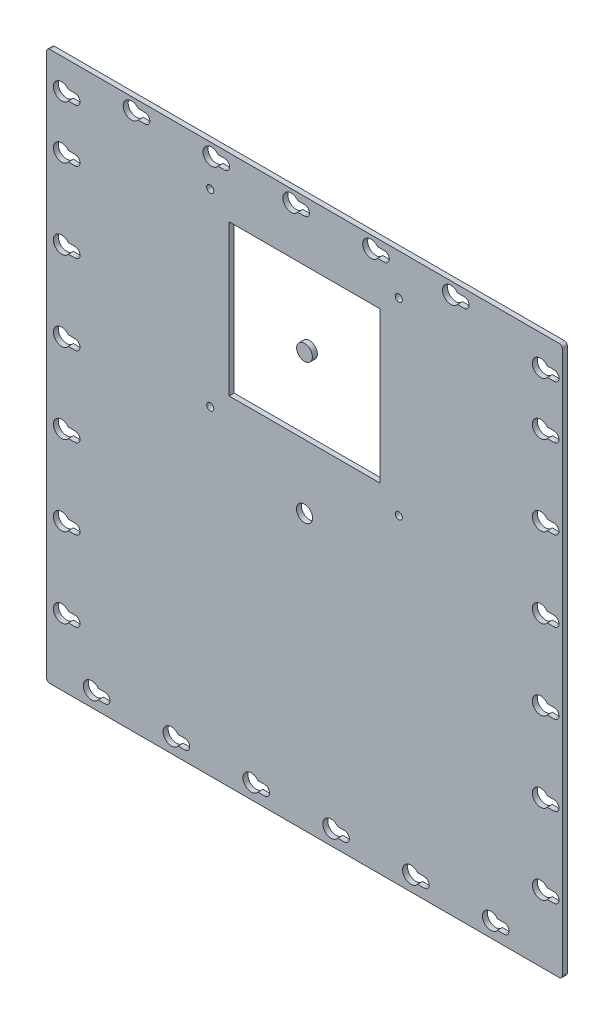
from build123d import *

# Parameters (mm, degrees)
SKETCH1_W           = 164.1
SKETCH1_H           = 174.745
SKETCH1_R           = 2.5527
BOSS_EXTRUDE1_DEPTH = 1.5875
FILLET1_R           = 1
SKETCH2_W           = 48
SKETCH2_H           = 48
SKETCH2_R           = 2.5
SKETCH2_R_2         = 1.13
CUT_EXTRUDE1_DEPTH  = 10


with BuildPart() as part:
    # Sketch1 → Boss-Extrude1 (new body)
    with BuildSketch(Plane.XY):
        with Locations((82.55, -87.3725)):
            Rectangle(SKETCH1_W, SKETCH1_H)
        with Locations((82.55, -87.3725)):
            Circle(SKETCH1_R, mode=Mode.SUBTRACT)
        with BuildLine():
            Line((82.55, -5.4375), (80.434372699, -5.4375))
            ThreePointArc((80.434372699, -5.4375), (75.6625, -3.85), (80.434372699, -2.2625))
            Line((80.434372699, -2.2625), (82.55, -2.2625))
            ThreePointArc((82.55, -2.2625), (84.1375, -3.85), (82.55, -5.4375))
        make_face(mode=Mode.SUBTRACT)
        with BuildLine():
            Line((16.934372699, -168.395), (19.05, -168.395))
            ThreePointArc((19.05, -168.395), (20.6375, -169.9825), (19.05, -171.57))
            Line((19.05, -171.57), (16.934372699, -171.57))
            ThreePointArc((16.934372699, -171.57), (12.1625, -169.9825), (16.934372699, -168.395))
        make_face(mode=Mode.SUBTRACT)
        with BuildLine():
            Line((7.409372699, -151.9325), (9.525, -151.9325))
            ThreePointArc((9.525, -151.9325), (11.1125, -153.52), (9.525, -155.1075))
            Line((9.525, -155.1075), (7.409372699, -155.1075))
            ThreePointArc((7.409372699, -155.1075), (2.6375, -153.52), (7.409372699, -151.9325))
        make_face(mode=Mode.SUBTRACT)
        with BuildLine():
            Line((42.334372699, -168.395), (44.45, -168.395))
            ThreePointArc((44.45, -168.395), (46.0375, -169.9825), (44.45, -171.57))
            Line((44.45, -171.57), (42.334372699, -171.57))
            ThreePointArc((42.334372699, -171.57), (37.5625, -169.9825), (42.334372699, -168.395))
        make_face(mode=Mode.SUBTRACT)
        with BuildLine():
            Line((67.734372699, -168.395), (69.85, -168.395))
            ThreePointArc((69.85, -168.395), (71.4375, -169.9825), (69.85, -171.57))
            Line((69.85, -171.57), (67.734372699, -171.57))
            ThreePointArc((67.734372699, -171.57), (62.9625, -169.9825), (67.734372699, -168.395))
        make_face(mode=Mode.SUBTRACT)
        with BuildLine():
            Line((7.409372699, -126.5325), (9.525, -126.5325))
            ThreePointArc((9.525, -126.5325), (11.1125, -128.12), (9.525, -129.7075))
            Line((9.525, -129.7075), (7.409372699, -129.7075))
            ThreePointArc((7.409372699, -129.7075), (2.6375, -128.12), (7.409372699, -126.5325))
        make_face(mode=Mode.SUBTRACT)
        with BuildLine():
            Line((7.409372699, -101.1325), (9.525, -101.1325))
            ThreePointArc((9.525, -101.1325), (11.1125, -102.72), (9.525, -104.3075))
            Line((9.525, -104.3075), (7.409372699, -104.3075))
            ThreePointArc((7.409372699, -104.3075), (2.6375, -102.72), (7.409372699, -101.1325))
        make_face(mode=Mode.SUBTRACT)
        with BuildLine():
            Line((7.409372699, -75.7325), (9.525, -75.7325))
            ThreePointArc((9.525, -75.7325), (11.1125, -77.32), (9.525, -78.9075))
            Line((9.525, -78.9075), (7.409372699, -78.9075))
            ThreePointArc((7.409372699, -78.9075), (2.6375, -77.32), (7.409372699, -75.7325))
        make_face(mode=Mode.SUBTRACT)
        with BuildLine():
            Line((7.409372699, -50.3325), (9.525, -50.3325))
            ThreePointArc((9.525, -50.3325), (11.1125, -51.92), (9.525, -53.5075))
            Line((9.525, -53.5075), (7.409372699, -53.5075))
            ThreePointArc((7.409372699, -53.5075), (2.6375, -51.92), (7.409372699, -50.3325))
        make_face(mode=Mode.SUBTRACT)
        with BuildLine():
            Line((7.409372699, -24.9325), (9.525, -24.9325))
            ThreePointArc((9.525, -24.9325), (11.1125, -26.52), (9.525, -28.1075))
            Line((9.525, -28.1075), (7.409372699, -28.1075))
            ThreePointArc((7.409372699, -28.1075), (2.6375, -26.52), (7.409372699, -24.9325))
        make_face(mode=Mode.SUBTRACT)
        with BuildLine():
            Line((7.409372699, -8.1), (9.525, -8.1))
            ThreePointArc((9.525, -8.1), (11.1125, -9.6875), (9.525, -11.275))
            Line((9.525, -11.275), (7.409372699, -11.275))
            ThreePointArc((7.409372699, -11.275), (2.6375, -9.6875), (7.409372699, -8.1))
        make_face(mode=Mode.SUBTRACT)
        with BuildLine():
            Line((29.634372699, -2.2625), (31.75, -2.2625))
            ThreePointArc((31.75, -2.2625), (33.3375, -3.85), (31.75, -5.4375))
            Line((31.75, -5.4375), (29.634372699, -5.4375))
            ThreePointArc((29.634372699, -5.4375), (24.8625, -3.85), (29.634372699, -2.2625))
        make_face(mode=Mode.SUBTRACT)
        with BuildLine():
            Line((55.034372699, -2.2625), (57.15, -2.2625))
            ThreePointArc((57.15, -2.2625), (58.7375, -3.85), (57.15, -5.4375))
            Line((57.15, -5.4375), (55.034372699, -5.4375))
            ThreePointArc((55.034372699, -5.4375), (50.2625, -3.85), (55.034372699, -2.2625))
        make_face(mode=Mode.SUBTRACT)
        with BuildLine():
            ThreePointArc((161.925, -8.1), (163.5125, -9.6875), (161.925, -11.275))
            Line((161.925, -11.275), (159.809372699, -11.275))
            ThreePointArc((159.809372699, -11.275), (155.0375, -9.6875), (159.809372699, -8.1))
            Line((159.809372699, -8.1), (161.925, -8.1))
        make_face(mode=Mode.SUBTRACT)
        with BuildLine():
            Line((93.134372699, -168.395), (95.25, -168.395))
            ThreePointArc((95.25, -168.395), (96.8375, -169.9825), (95.25, -171.57))
            Line((95.25, -171.57), (93.134372699, -171.57))
            ThreePointArc((93.134372699, -171.57), (88.3625, -169.9825), (93.134372699, -168.395))
        make_face(mode=Mode.SUBTRACT)
        with BuildLine():
            Line((118.534372699, -168.395), (120.65, -168.395))
            ThreePointArc((120.65, -168.395), (122.2375, -169.9825), (120.65, -171.57))
            Line((120.65, -171.57), (118.534372699, -171.57))
            ThreePointArc((118.534372699, -171.57), (113.7625, -169.9825), (118.534372699, -168.395))
        make_face(mode=Mode.SUBTRACT)
        with BuildLine():
            Line((143.934372699, -168.395), (146.05, -168.395))
            ThreePointArc((146.05, -168.395), (147.6375, -169.9825), (146.05, -171.57))
            Line((146.05, -171.57), (143.934372699, -171.57))
            ThreePointArc((143.934372699, -171.57), (139.1625, -169.9825), (143.934372699, -168.395))
        make_face(mode=Mode.SUBTRACT)
        with BuildLine():
            Line((159.809372699, -151.9325), (161.925, -151.9325))
            ThreePointArc((161.925, -151.9325), (163.5125, -153.52), (161.925, -155.1075))
            Line((161.925, -155.1075), (159.809372699, -155.1075))
            ThreePointArc((159.809372699, -155.1075), (155.0375, -153.52), (159.809372699, -151.9325))
        make_face(mode=Mode.SUBTRACT)
        with BuildLine():
            Line((159.809372699, -126.5325), (161.925, -126.5325))
            ThreePointArc((161.925, -126.5325), (163.5125, -128.12), (161.925, -129.7075))
            Line((161.925, -129.7075), (159.809372699, -129.7075))
            ThreePointArc((159.809372699, -129.7075), (155.0375, -128.12), (159.809372699, -126.5325))
        make_face(mode=Mode.SUBTRACT)
        with BuildLine():
            Line((159.809372699, -101.1325), (161.925, -101.1325))
            ThreePointArc((161.925, -101.1325), (163.5125, -102.72), (161.925, -104.3075))
            Line((161.925, -104.3075), (159.809372699, -104.3075))
            ThreePointArc((159.809372699, -104.3075), (155.0375, -102.72), (159.809372699, -101.1325))
        make_face(mode=Mode.SUBTRACT)
        with BuildLine():
            Line((159.809372699, -75.7325), (161.925, -75.7325))
            ThreePointArc((161.925, -75.7325), (163.5125, -77.32), (161.925, -78.9075))
            Line((161.925, -78.9075), (159.809372699, -78.9075))
            ThreePointArc((159.809372699, -78.9075), (155.0375, -77.32), (159.809372699, -75.7325))
        make_face(mode=Mode.SUBTRACT)
        with BuildLine():
            Line((159.809372699, -50.3325), (161.925, -50.3325))
            ThreePointArc((161.925, -50.3325), (163.5125, -51.92), (161.925, -53.5075))
            Line((161.925, -53.5075), (159.809372699, -53.5075))
            ThreePointArc((159.809372699, -53.5075), (155.0375, -51.92), (159.809372699, -50.3325))
        make_face(mode=Mode.SUBTRACT)
        with BuildLine():
            Line((105.834372699, -2.2625), (107.95, -2.2625))
            ThreePointArc((107.95, -2.2625), (109.5375, -3.85), (107.95, -5.4375))
            Line((107.95, -5.4375), (105.834372699, -5.4375))
            ThreePointArc((105.834372699, -5.4375), (101.0625, -3.85), (105.834372699, -2.2625))
        make_face(mode=Mode.SUBTRACT)
        with BuildLine():
            Line((159.809372699, -24.9325), (161.925, -24.9325))
            ThreePointArc((161.925, -24.9325), (163.5125, -26.52), (161.925, -28.1075))
            Line((161.925, -28.1075), (159.809372699, -28.1075))
            ThreePointArc((159.809372699, -28.1075), (155.0375, -26.52), (159.809372699, -24.9325))
        make_face(mode=Mode.SUBTRACT)
        with BuildLine():
            Line((131.234372699, -2.2625), (133.35, -2.2625))
            ThreePointArc((133.35, -2.2625), (134.9375, -3.85), (133.35, -5.4375))
            Line((133.35, -5.4375), (131.234372699, -5.4375))
            ThreePointArc((131.234372699, -5.4375), (126.4625, -3.85), (131.234372699, -2.2625))
        make_face(mode=Mode.SUBTRACT)
    extrude(amount=BOSS_EXTRUDE1_DEPTH)

    # Fillet1
    fillet1_edges = [part.edges().sort_by_distance(p)[0] for p in [
        (0.5, -174.745, 0.79375),
        (0.5, 0, 0.79375),
        (164.6, 0, 0.79375),
        (164.6, -174.745, 0.79375),
    ]]
    fillet(fillet1_edges, radius=FILLET1_R)

    # Sketch2 → Cut-Extrude1 (cut)
    # profile 1 of 5: a face of its own
    with BuildSketch(Plane.XY.offset(1.5875)):
        with Locations((82.55, -42.98836)):
            Rectangle(SKETCH2_W, SKETCH2_H)
        with Locations((82.55, -42.98836)):
            Circle(SKETCH2_R, mode=Mode.SUBTRACT)
    # profile 2 of 5: a face of its own
    with BuildSketch(Plane.XY.offset(1.5875)):
        with Locations((112.55, -12.98836)):
            Circle(SKETCH2_R_2)
    # profile 3 of 5: a face of its own
    with BuildSketch(Plane.XY.offset(1.5875)):
        with Locations((112.55, -72.98836)):
            Circle(SKETCH2_R_2)
    # profile 4 of 5: a face of its own
    with BuildSketch(Plane.XY.offset(1.5875)):
        with Locations((52.55, -72.98836)):
            Circle(SKETCH2_R_2)
    # profile 5 of 5: a face of its own
    with BuildSketch(Plane.XY.offset(1.5875)):
        with Locations((52.55, -12.98836)):
            Circle(SKETCH2_R_2)
    extrude(amount=-CUT_EXTRUDE1_DEPTH, mode=Mode.SUBTRACT)


with BuildPart() as cut_extrude1_piece_1:
    # of the separate pieces the step leaves, piece 1, a body of its own (cut_extrude1_pieces)
    add(part.part.solids().sort_by_distance((0.5, -1, 0))[0])


with BuildPart() as cut_extrude1_piece_2:
    # of the separate pieces the step leaves, piece 2, a body of its own (cut_extrude1_pieces)
    add(part.part.solids().sort_by_distance((85.05, -42.98836, 0))[0])


solid = Compound([cut_extrude1_piece_1.part, cut_extrude1_piece_2.part])
